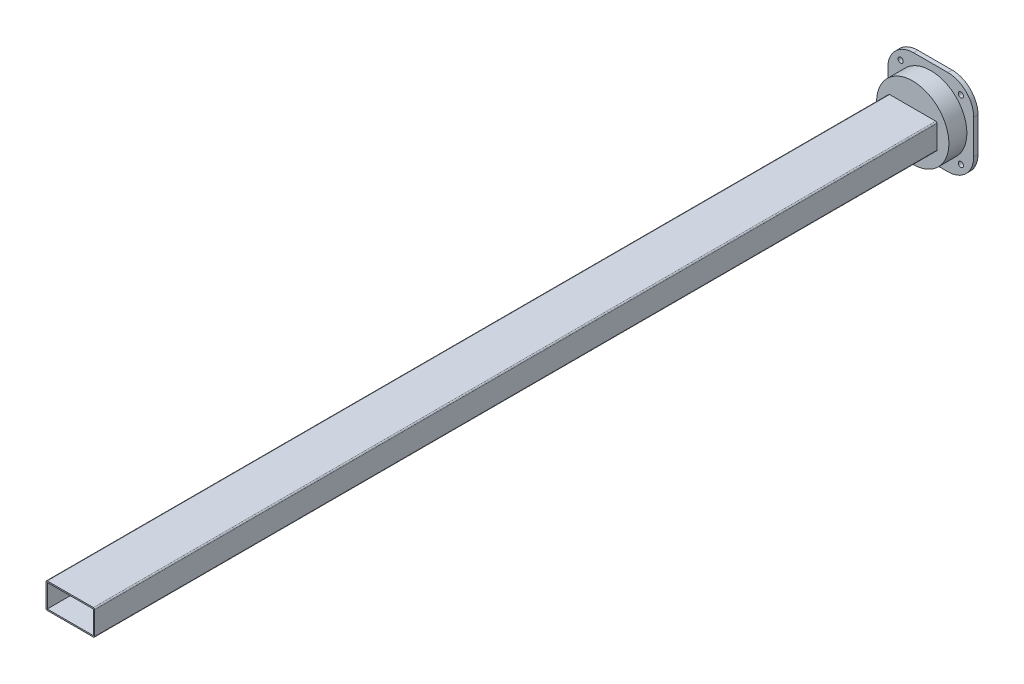
from build123d import *

# Parameters (mm, degrees)
SKETCH_2_W               = 53.534
SKETCH_2_H               = 26.767
EXTRUDE_1_DEPTH          = 1000
EXTRUDE_2_DEPTH          = 5
SKETCH_8_W               = 53.534
SKETCH_8_H               = 26.767
CUT_EXTRUDE_2_DEPTH      = 1010
SKETCH_9_R               = 40
SKETCH_9_R_2             = 35
CUT_EXTRUDE_4_DEPTH      = 1010
SKETCH_10_R              = 3
CUT_EXTRUDE_7_DEPTH      = 1010
SKETCH_11_R              = 42
EXTRUDE_3_DEPTH          = 25.94125
SKETCH_9_2_R             = 40
SKETCH_9_2_R_2           = 35
CUT_EXTRUDE_8_DEPTH      = 23.94125
CUT_EXTRUDE_9_DEPTH      = 23.94125
CUT_EXTRUDE_9_DEPTH_BACK = 2000
SKETCH_8_2_W             = 53.534
SKETCH_8_2_H             = 26.767


with BuildPart() as part:
    # Эскиз2 → Бобышка-Вытянуть1 (new body)
    with BuildSketch(Plane.XY):
        with BuildLine():
            Line((-26.767, 14.8835), (26.767, 14.8835))
            ThreePointArc((26.767, 14.8835), (27.827660172, 14.444160172), (28.267, 13.3835))
            Line((28.267, 13.3835), (28.267, -13.3835))
            ThreePointArc((28.267, -13.3835), (27.827660172, -14.444160172), (26.767, -14.8835))
            Line((26.767, -14.8835), (-26.767, -14.8835))
            ThreePointArc((-26.767, -14.8835), (-27.827660172, -14.444160172), (-28.267, -13.3835))
            Line((-28.267, -13.3835), (-28.267, 13.3835))
            ThreePointArc((-28.267, 13.3835), (-27.827660172, 14.444160172), (-26.767, 14.8835))
        make_face()
        Rectangle(SKETCH_2_W, SKETCH_2_H, mode=Mode.SUBTRACT)
    extrude(amount=EXTRUDE_1_DEPTH)

    # Эскиз6 → Бобышка-Вытянуть2 (add)
    with BuildSketch(Plane(origin=(0, 0, 0), x_dir=(-1, 0, 0), z_dir=(0, 0, -1))):
        with BuildLine():
            Line((-19.929966526, 49.955317788), (19.929966526, 49.955317788))
            ThreePointArc((19.929966526, 49.955317788), (41.143169962, 41.168521224), (49.929966526, 19.955317788))
            Line((49.929966526, 19.955317788), (49.929966526, -19.955317788))
            ThreePointArc((49.929966526, -19.955317788), (41.143169962, -41.168521224), (19.929966526, -49.955317788))
            Line((19.929966526, -49.955317788), (-19.929966526, -49.955317788))
            ThreePointArc((-19.929966526, -49.955317788), (-41.143169962, -41.168521224), (-49.929966526, -19.955317788))
            Line((-49.929966526, -19.955317788), (-49.929966526, 19.955317788))
            ThreePointArc((-49.929966526, 19.955317788), (-41.143169962, 41.168521224), (-19.929966526, 49.955317788))
        make_face()
    extrude(amount=EXTRUDE_2_DEPTH)

    # Эскиз8 → Вырез-Вытянуть2 (cut)
    with BuildSketch(Plane.XY.offset(1000)):
        Rectangle(SKETCH_8_W, SKETCH_8_H)
    extrude(amount=-CUT_EXTRUDE_2_DEPTH, mode=Mode.SUBTRACT)

    # Эскиз9 → Вырез-Вытянуть4 (cut)
    with BuildSketch(Plane(origin=(0, 0, -5), x_dir=(-1, 0, 0), z_dir=(0, 0, -1))):
        Circle(SKETCH_9_R)
        Circle(SKETCH_9_R_2, mode=Mode.SUBTRACT)
    extrude(amount=-CUT_EXTRUDE_4_DEPTH, mode=Mode.SUBTRACT)


with BuildPart() as cut_extrude_4_piece_1:
    # of the separate pieces the step leaves, piece 1, a body of its own (cut_extrude_4_pieces)
    add(part.part.solids().sort_by_distance((-35, 0, 0))[0])



with BuildPart() as cut_extrude_4_piece_2:
    # of the separate pieces the step leaves, piece 2, a body of its own (cut_extrude_4_pieces)
    add(part.part.solids().sort_by_distance((19.929966526, 49.955317788, 0))[0])

    # Эскиз10 → Вырез-Вытянуть7 (cut)
    with BuildSketch(Plane(origin=(0, 0, -5), x_dir=(-1, 0, 0), z_dir=(0, 0, -1))):
        with Locations((-35, 35)):
            Circle(SKETCH_10_R)
        with Locations((-35, -35)):
            Circle(SKETCH_10_R)
        with Locations((35, -35)):
            Circle(SKETCH_10_R)
        with Locations((35, 35)):
            Circle(SKETCH_10_R)
    extrude(amount=-CUT_EXTRUDE_7_DEPTH, mode=Mode.SUBTRACT)


with BuildPart() as cut_extrude_4_piece_1_1:
    add(cut_extrude_4_piece_1.part)

    add(cut_extrude_4_piece_2.part)  # Бобышка-Вытянуть3 merges Вырез-Вытянуть4 piece 2
    # Эскиз11 → Бобышка-Вытянуть3 (add)
    with BuildSketch(Plane(origin=(0, 0, -5), x_dir=(-1, 0, 0), z_dir=(0, 0, -1))):
        Circle(SKETCH_11_R)
    extrude(amount=-EXTRUDE_3_DEPTH)

    # Эскиз9<2> → Вырез-Вытянуть8 (cut)
    with BuildSketch(Plane(origin=(0, 0, -5), x_dir=(-1, 0, 0), z_dir=(0, 0, -1))):
        Circle(SKETCH_9_2_R)
        Circle(SKETCH_9_2_R_2, mode=Mode.SUBTRACT)
    extrude(amount=-CUT_EXTRUDE_8_DEPTH, mode=Mode.SUBTRACT)

    # Эскиз8<2> → Вырез-Вытянуть9 (cut, two sides: drawn at the far end of the back side and taken through both)
    with BuildSketch(Plane.XY.offset(1000).offset(-CUT_EXTRUDE_9_DEPTH_BACK)):
        Rectangle(SKETCH_8_2_W, SKETCH_8_2_H)
    extrude(amount=CUT_EXTRUDE_9_DEPTH + CUT_EXTRUDE_9_DEPTH_BACK, mode=Mode.SUBTRACT)


solid = cut_extrude_4_piece_1_1.part
